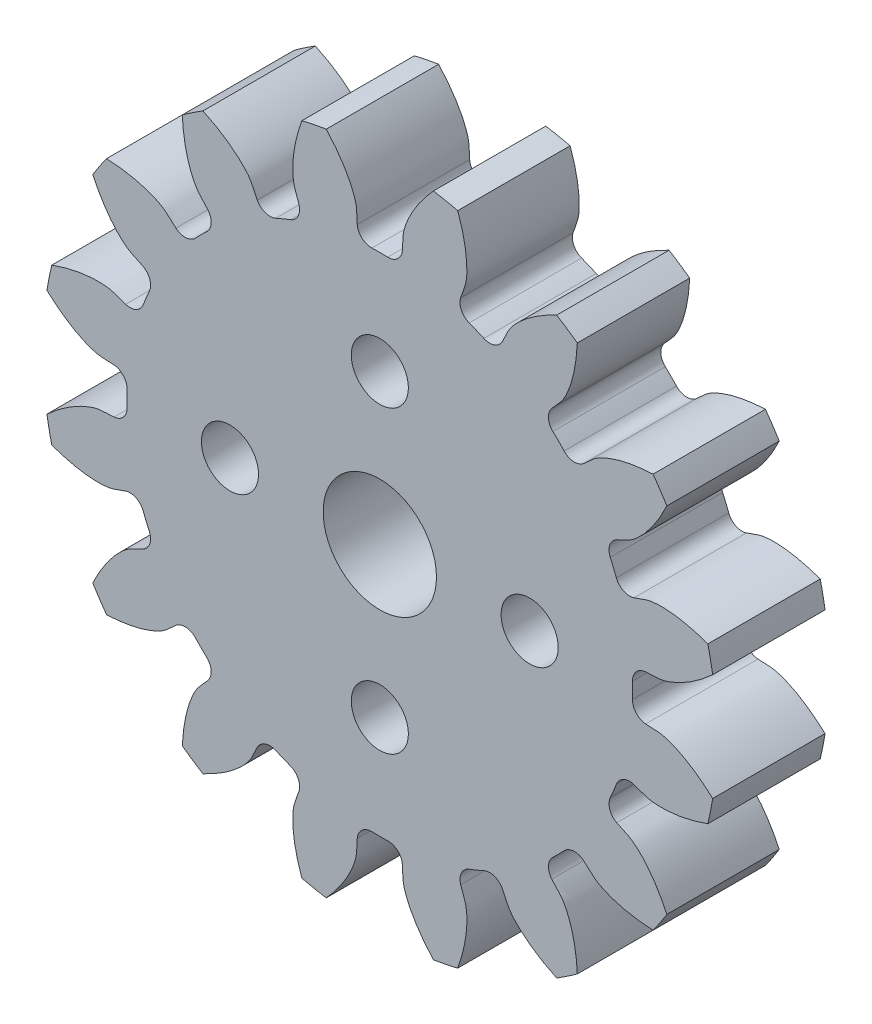
from build123d import *

# Parameters (mm, degrees)
SKETCH_1_R          = 18
LASHENA_DEPTH       = 6
CUT_EXTRUDEA_DEPTH  = 30
WWW_KYTOOL_CN_COUNT = 16
SKETCH_5_R          = 3.025
CUT_EXTRUDE_2_DEPTH = 10
SKETCH_6_R          = 1.525
CUT_EXTRUDE_3_DEPTH = 10


with BuildPart() as part:
    # 草图1 → LaShenA (new body)
    with BuildSketch(Plane.XY):
        Circle(SKETCH_1_R)
    extrude(amount=LASHENA_DEPTH)

    # SketchA → Cut-ExtrudeA (cut)
    with BuildSketch(Plane.XY.offset(6)):
        with BuildLine():
            ThreePointArc((0.423212707, 13.493364703), (0, 13.5), (-0.423212707, 13.493364703))
            ThreePointArc((-0.423212707, 13.493364703), (-0.952770902, 13.685686791), (-1.20440395, 14.18977059))
            add(Edge.make_bspline(
                [(-1.20440395, 14.18977059), (-1.226562505, 14.455224305), (-1.213843633, 14.773889884), (-1.273675597, 15.110607864), (-1.299119688, 15.21139578), (-1.321432077, 15.29109757), (-1.349914152, 15.382250837), (-1.385146673, 15.484587535), (-1.427834192, 15.597770763), (-1.478623281, 15.721446817), (-1.538159915, 15.855229004), (-1.607069773, 15.998703507), (-1.685962928, 16.151428337), (-1.775430978, 16.312934487), (-1.876046532, 16.482726463), (-1.98836201, 16.660283053), (-2.112908684, 16.845058076), (-2.250195688, 17.036481179), (-2.400709063, 17.233958676), (-2.56491084, 17.43687441), (-2.743238138, 17.644590662), (-2.936102365, 17.856449073), (-3.14388814, 18.07177164), (-3.447378451, 18.368492697), (-3.689495989, 18.585006365), (-3.858042439, 18.727457792)],
                knots=[0.122308221, 0.122308221, 0.122308221, 0.122308221, 0.250610689, 0.276296194, 0.287604067, 0.300967916, 0.316387742, 0.333863545, 0.353395324, 0.37498308, 0.398626813, 0.424326522, 0.452082207, 0.48189387, 0.513761509, 0.547685125, 0.583664717, 0.621700286, 0.661791832, 0.703939355, 0.748142854, 0.79440233, 0.842717782, 0.893089212, 1, 1, 1, 1], degree=3))
            ThreePointArc((-3.858042439, 18.727457792), (0, 19.120726106), (3.858042439, 18.727457792))
            add(Edge.make_bspline(
                [(1.20440395, 14.18977059), (1.226562505, 14.455224305), (1.213843633, 14.773889884), (1.273675597, 15.110607864), (1.299119688, 15.21139578), (1.321432077, 15.29109757), (1.349914152, 15.382250837), (1.385146673, 15.484587535), (1.427834192, 15.597770763), (1.478623281, 15.721446817), (1.538159915, 15.855229004), (1.607069773, 15.998703507), (1.685962928, 16.151428337), (1.775430978, 16.312934487), (1.876046532, 16.482726463), (1.98836201, 16.660283053), (2.112908684, 16.845058076), (2.250195688, 17.036481179), (2.400709063, 17.233958676), (2.56491084, 17.43687441), (2.743238138, 17.644590662), (2.936102365, 17.856449073), (3.14388814, 18.07177164), (3.447378451, 18.368492697), (3.689495989, 18.585006365), (3.858042439, 18.727457792)],
                knots=[0.122308221, 0.122308221, 0.122308221, 0.122308221, 0.250610689, 0.276296194, 0.287604067, 0.300967916, 0.316387742, 0.333863545, 0.353395324, 0.37498308, 0.398626813, 0.424326522, 0.452082207, 0.48189387, 0.513761509, 0.547685125, 0.583664717, 0.621700286, 0.661791832, 0.703939355, 0.748142854, 0.79440233, 0.842717782, 0.893089212, 1, 1, 1, 1], degree=3))
            ThreePointArc((1.20440395, 14.18977059), (0.952770902, 13.685686791), (0.423212707, 13.493364703))
        make_face()
    cut_extrudea = extrude(amount=-CUT_EXTRUDEA_DEPTH, mode=Mode.SUBTRACT)

    # www.KYTool.cn: Cut-ExtrudeA ×16 about axis
    www_kytool_cn_axis = Axis((0, 0, -88.99), (0, 0, 1))
    for i in range(1, WWW_KYTOOL_CN_COUNT):
        add(cut_extrudea.rotate(www_kytool_cn_axis, i * 360 / WWW_KYTOOL_CN_COUNT), mode=Mode.SUBTRACT)

    # 草图5 → 切除-拉伸2 (cut)
    with BuildSketch(Plane.XY.offset(6)):
        Circle(SKETCH_5_R)
    extrude(amount=-CUT_EXTRUDE_2_DEPTH, mode=Mode.SUBTRACT)

    # 草图6 → 切除-拉伸3 (cut)
    with BuildSketch(Plane(origin=(0, 0, 0), x_dir=(-1, 0, 0), z_dir=(0, 0, -1))):
        with Locations((0, 8)):
            Circle(SKETCH_6_R)
        with Locations((0, -8)):
            Circle(SKETCH_6_R)
        with Locations((8, 0)):
            Circle(SKETCH_6_R)
        with Locations((-8, 0)):
            Circle(SKETCH_6_R)
    extrude(amount=-CUT_EXTRUDE_3_DEPTH, mode=Mode.SUBTRACT)


solid = part.part
